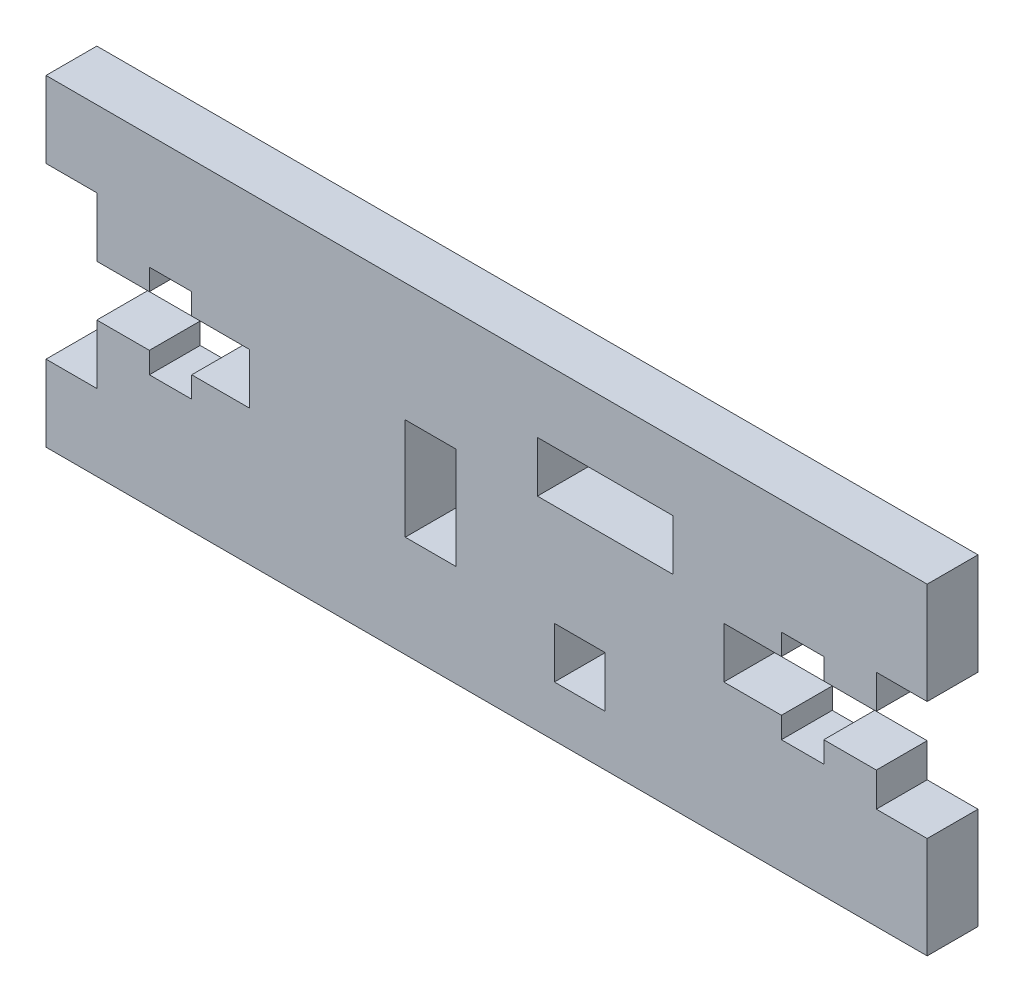
from build123d import *

# Parameters (mm, degrees)
ESBO_O1_W                     = 46
ESBO_O1_H                     = 19
RESSALTO_EXTRUS_O1_DEPTH      = 1.5
CORTE_EXTRUS_O3_DEPTH         = 25.929901725
CORTE_EXTRUS_O3_DEPTH_BACK    = 25.929901725
ESBO_O6_W                     = 3
ESBO_O6_H                     = 6
CORTE_EXTRUS_O2_DEPTH         = 25.929901725
CORTE_EXTRUS_O2_DEPTH_BACK    = 25.929901725
DENTE_W                       = 3
DENTE_H                       = 3
RESSALTO_EXTRUS_O3_DEPTH      = 1.5
RESSALTO_EXTRUS_O3_DEPTH_BACK = 1.5
ESBO_O4_W                     = 3
ESBO_O4_H                     = 6
ESBO_O21_W                    = 9
ESBO_O21_H                    = 3
ESBO_O21_W_2                  = 2.5
ESBO_O21_H_2                  = 5.5
CORTE_EXTRUS_O11_DEPTH        = 3
ESBO_O3_W                     = 3
ESBO_O3_H                     = 4.5
RESSALTO_EXTRUS_O2_DEPTH      = 1.5
CORTE_EXTRUS_O12_DEPTH        = 28.721832551
CORTE_EXTRUS_O12_DEPTH_BACK   = 28.721832551
ESBO_O23_W                    = 8
ESBO_O23_H                    = 3


with BuildPart() as part:
    # Esboço1 → Ressalto-extrusão1 (new, symmetric)
    with BuildSketch(Plane.XY):
        Rectangle(ESBO_O1_W, ESBO_O1_H)
    extrude(amount=RESSALTO_EXTRUS_O1_DEPTH, both=True)

    # Esboço6 → Corte-extrusão3 (cut, two sides: drawn at the far end of the back side and taken through both)
    with BuildSketch(Plane.XY.offset(-CORTE_EXTRUS_O3_DEPTH_BACK)):
        with Locations((-3.3, -0.5)):
            Rectangle(ESBO_O6_W, ESBO_O6_H)
    extrude(amount=CORTE_EXTRUS_O3_DEPTH + CORTE_EXTRUS_O3_DEPTH_BACK, mode=Mode.SUBTRACT)

    # Dente → Corte-extrusão2 (cut, two sides: drawn at the far end of the back side and taken through both)
    with BuildSketch(Plane.XY.offset(-CORTE_EXTRUS_O2_DEPTH_BACK)):
        with Locations((5.5, -5)):
            Rectangle(DENTE_W, DENTE_H)
    extrude(amount=CORTE_EXTRUS_O2_DEPTH + CORTE_EXTRUS_O2_DEPTH_BACK, mode=Mode.SUBTRACT)

    # Esboço4 → Ressalto-extrusão3 (add, two sides: drawn at the far end of the back side and taken through both)
    with BuildSketch(Plane.XY.offset(-RESSALTO_EXTRUS_O3_DEPTH_BACK)):
        with Locations((24.5, 6.5)):
            Rectangle(ESBO_O4_W, ESBO_O4_H)
        with Locations((24.5, -6.5)):
            Rectangle(ESBO_O4_W, ESBO_O4_H)
    extrude(amount=RESSALTO_EXTRUS_O3_DEPTH + RESSALTO_EXTRUS_O3_DEPTH_BACK)

    # Esboço21 → Corte-extrusão11 (cut)
    with BuildSketch(Plane(origin=(2.822956614, -2.284701659, 1.5), x_dir=(1, 0, 0), z_dir=(0, 0, 1))):
        with Locations((-21.322956614, 2.284701659)):
            Rectangle(ESBO_O21_W, ESBO_O21_H)
        with Locations((-21.472956614, 2.284701659)):
            Rectangle(ESBO_O21_W_2, ESBO_O21_H_2)
    corte_extrus_o11 = extrude(amount=-CORTE_EXTRUS_O11_DEPTH, mode=Mode.SUBTRACT)

    # Espelhar3: Corte-extrusão11 across plane
    add(corte_extrus_o11.mirror(Plane(origin=(0, 0, 0), x_dir=(0, 0, 1), z_dir=(1, 0, 0))), mode=Mode.SUBTRACT)

    # Esboço3 → Ressalto-extrusão2 (add, symmetric)
    with BuildSketch(Plane.XY):
        with Locations((-24.5, -7.25)):
            Rectangle(ESBO_O3_W, ESBO_O3_H)
    ressalto_extrus_o2 = extrude(amount=RESSALTO_EXTRUS_O2_DEPTH, both=True)

    # Espelhar2: Corte-extrusão11, Ressalto-extrusão2 across plane
    add(corte_extrus_o11.mirror(Plane.ZX), mode=Mode.SUBTRACT)
    add(ressalto_extrus_o2.mirror(Plane.ZX))

    # Esboço23 → Corte-extrusão12 (cut, two sides: drawn at the far end of the back side and taken through both)
    with BuildSketch(Plane.XY.offset(-CORTE_EXTRUS_O12_DEPTH_BACK)):
        with Locations((7, 4)):
            Rectangle(ESBO_O23_W, ESBO_O23_H)
    extrude(amount=CORTE_EXTRUS_O12_DEPTH + CORTE_EXTRUS_O12_DEPTH_BACK, mode=Mode.SUBTRACT)


solid = part.part
